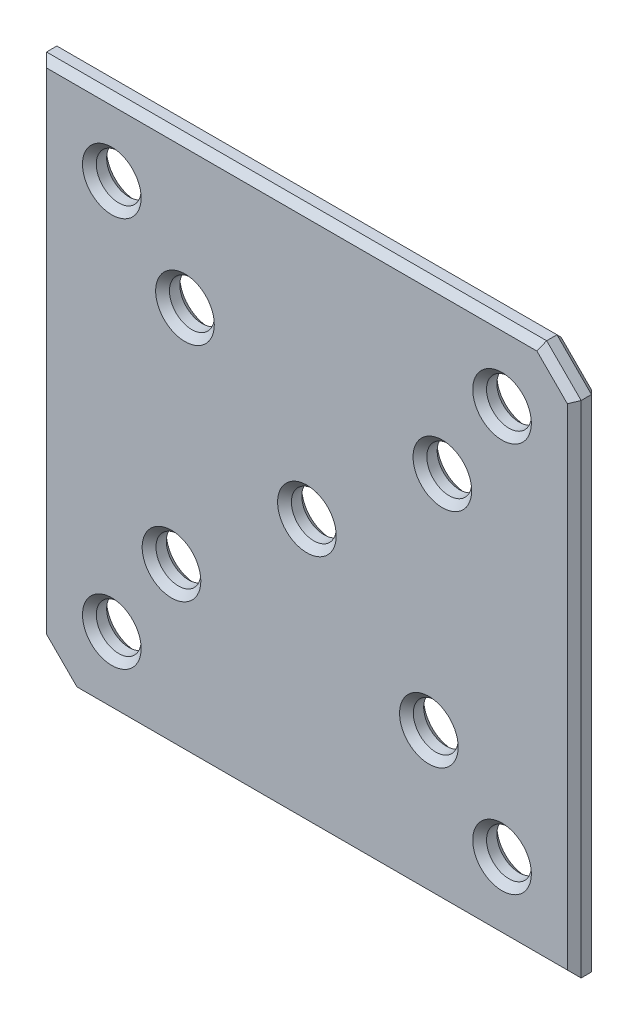
from build123d import *

# Parameters (mm, degrees)
SKETCH_1_R         = 13
EXTRUDE_1135_DEPTH = 14
CHAMFER_1_SIZE     = 4


with BuildPart() as part:
    # 草图1 → Extrude 1135 (new body)
    with BuildSketch(Plane.XY):
        Polygon((135, 155), (155, 135), (155, -155), (-135, -155), (-155, -135), (-155, 155), align=None)
        with Locations((-113.13708499, -113.13708499)):
            Circle(SKETCH_1_R, mode=Mode.SUBTRACT)
        with Locations((-78.524110604, -61.919012055)):
            Circle(SKETCH_1_R, mode=Mode.SUBTRACT)
        with Locations((78.524110604, 61.919012055)):
            Circle(SKETCH_1_R, mode=Mode.SUBTRACT)
        with Locations((113.13708499, 113.13708499)):
            Circle(SKETCH_1_R, mode=Mode.SUBTRACT)
        with Locations((-70.710678119, 70.710678119)):
            Circle(SKETCH_1_R, mode=Mode.SUBTRACT)
        with Locations((-113.13708499, 113.13708499)):
            Circle(SKETCH_1_R, mode=Mode.SUBTRACT)
        with Locations(Location((70.710678119, -70.710678119, 0), (0, 0, 180))):
            Circle(SKETCH_1_R, mode=Mode.SUBTRACT)
        with Locations(Location((113.13708499, -113.13708499, 0), (0, 0, 180))):
            Circle(SKETCH_1_R, mode=Mode.SUBTRACT)
        Circle(SKETCH_1_R, mode=Mode.SUBTRACT)
    extrude(amount=EXTRUDE_1135_DEPTH)

    # 倒角1
    chamfer_1_edges = [part.edges().sort_by_distance(p)[0] for p in [
        (10, -155, 14),
        (155, -10, 14),
        (145, 145, 14),
        (-126.13708499, -113.13708499, 0),
        (-126.13708499, -113.13708499, 14),
        (-10, 155, 14),
        (-91.524110604, -61.919012055, 0),
        (-91.524110604, -61.919012055, 14),
        (65.524110604, 61.919012055, 0),
        (65.524110604, 61.919012055, 14),
        (100.13708499, 113.13708499, 0),
        (100.13708499, 113.13708499, 14),
        (-83.710678119, 70.710678119, 0),
        (-83.710678119, 70.710678119, 14),
        (-126.13708499, 113.13708499, 0),
        (-126.13708499, 113.13708499, 14),
        (83.710678119, -70.710678119, 0),
        (83.710678119, -70.710678119, 14),
        (-155, 10, 14),
        (-13, 0, 0),
        (-13, 0, 14),
        (126.13708499, -113.13708499, 0),
        (126.13708499, -113.13708499, 14),
        (-10, 155, 0),
        (145, 145, 0),
        (155, -10, 0),
        (-145, -145, 14),
        (10, -155, 0),
        (-145, -145, 0),
        (-155, 10, 0),
    ]]
    chamfer(chamfer_1_edges, length=CHAMFER_1_SIZE)


solid = part.part
